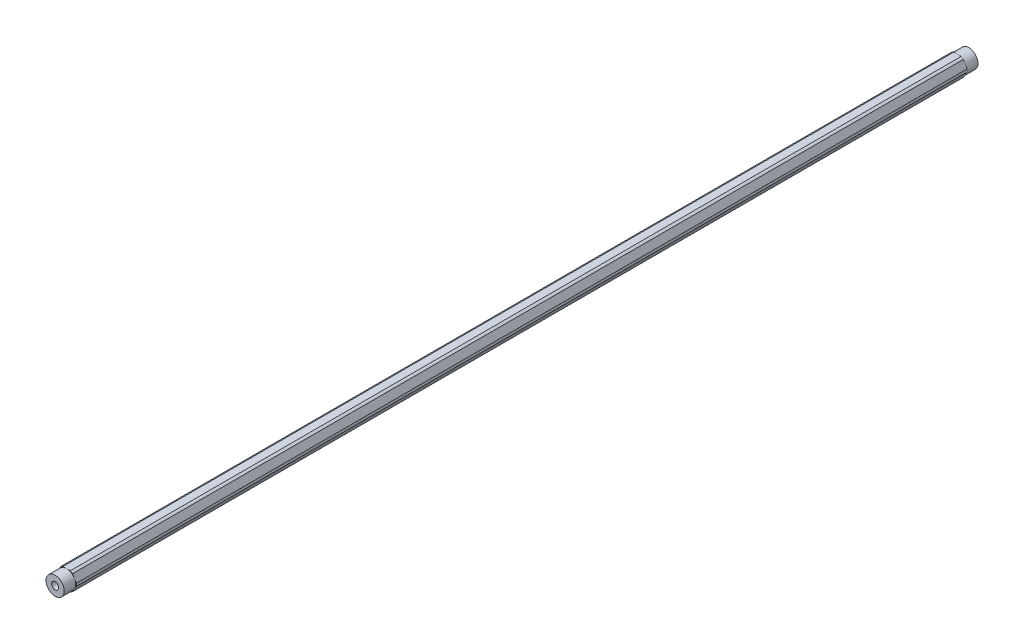
from build123d import *

# Parameters (mm, degrees)
BOSS_EXTRUDE1_DEPTH = 317.5
SKETCH3_OUTSIDE_W   = 143.724
SKETCH3_OUTSIDE_H   = 141.76
SKETCH3_OUTSIDE_R   = 6.35
CUT_EXTRUDE2_DEPTH  = 7.9502
SKETCH4_OUTSIDE_W   = 143.724
SKETCH4_OUTSIDE_H   = 141.76
SKETCH4_OUTSIDE_R   = 6.858
CUT_EXTRUDE3_DEPTH  = 636.074079012
SKETCH5_R           = 2.4892
CUT_EXTRUDE4_DEPTH  = 636.068779475


with BuildPart() as part:
    # Sketch1 → Boss-Extrude1 (new, symmetric)
    with BuildSketch(Plane.XY):
        Polygon((7.332348419, 0), (3.666174209, 6.35), (-3.666174209, 6.35), (-7.332348419, 0), (-3.666174209, -6.35), (3.666174209, -6.35), align=None)
    extrude(amount=BOSS_EXTRUDE1_DEPTH, both=True)

    # Sketch3 outside → Cut-Extrude2 (cut)
    with BuildSketch(Plane.XY.offset(317.5)):
        Rectangle(SKETCH3_OUTSIDE_W, SKETCH3_OUTSIDE_H)
        Circle(SKETCH3_OUTSIDE_R, mode=Mode.SUBTRACT)
    cut_extrude2 = extrude(amount=-CUT_EXTRUDE2_DEPTH, mode=Mode.SUBTRACT)

    # Mirror1: Cut-Extrude2 across plane
    add(cut_extrude2.mirror(Plane.XY), mode=Mode.SUBTRACT)

    # Sketch4 outside → Cut-Extrude3 (cut, through all)
    with BuildSketch(Plane.XY.offset(317.5)):
        Rectangle(SKETCH4_OUTSIDE_W, SKETCH4_OUTSIDE_H)
        Circle(SKETCH4_OUTSIDE_R, mode=Mode.SUBTRACT)
    extrude(amount=-CUT_EXTRUDE3_DEPTH, mode=Mode.SUBTRACT)

    # Sketch5 → Cut-Extrude4 (cut, through all)
    with BuildSketch(Plane.XY.offset(317.5)):
        Circle(SKETCH5_R)
    extrude(amount=-CUT_EXTRUDE4_DEPTH, mode=Mode.SUBTRACT)


solid = part.part
